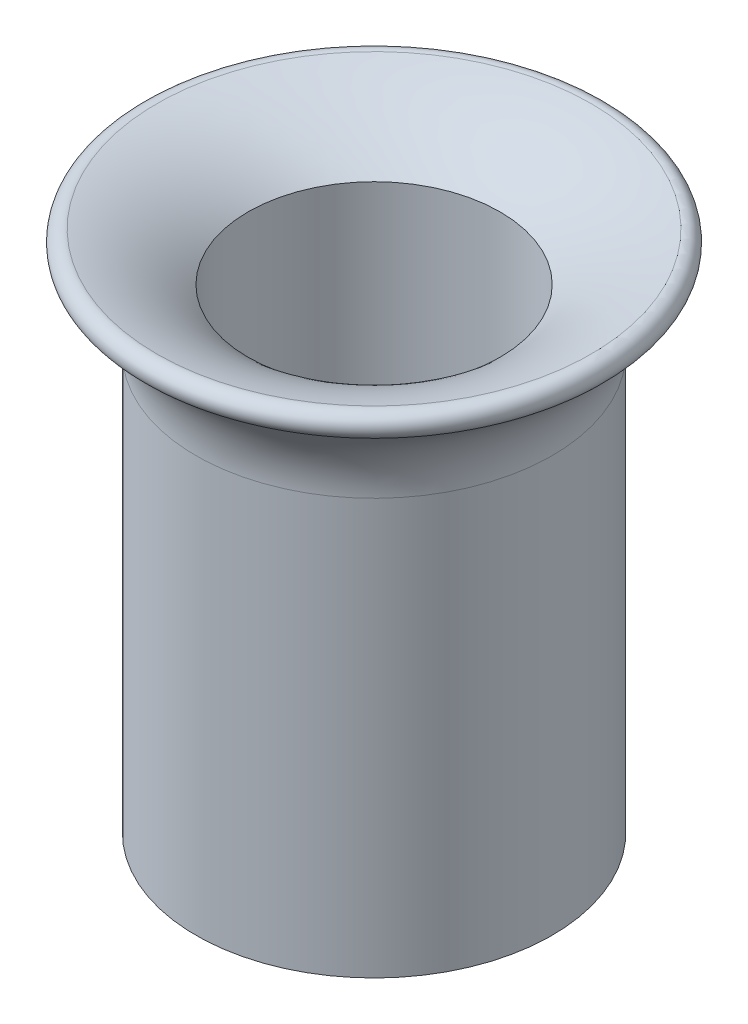
from build123d import *

# Parameters (mm, degrees)
SKETCH3_R          = 21.233227614
CUT_EXTRUDE1_DEPTH = 70


with BuildPart() as part:
    # Sketch1 → Revolve2 (revolve)
    with BuildSketch(Plane.XY, mode=Mode.PRIVATE) as revolve2_sk:
        with BuildLine():
            Line((0, 0), (30, 0))
            Line((30, 0), (30, 80))
            Line((30, 80), (8.888669742, 80))
            Line((8.888669742, 80), (8.766772386, 80))
            ThreePointArc((8.766772386, 80), (1.622655606, 85.063799106), (-6.577845512, 88.134995516))
            ThreePointArc((-6.577845512, 88.134995516), (-8.881517974, 86.949044637), (-8.081497092, 84.484627285))
            ThreePointArc((-8.081497092, 84.484627285), (-2.157248411, 78.299991195), (0, 70.011883734))
            Line((0, 70.011883734), (0, 0))
        make_face()
    revolve(revolve2_sk.sketch.rotate(Axis((30, 0, 0), (0, 1, 0)), 270), axis=Axis((30, 0, 0), (0, 1, 0)))

    # Sketch3 → Cut-Extrude1 (cut)
    with BuildSketch(Plane(origin=(0, 80, 0), x_dir=(1, 0, 0), z_dir=(0, 1, 0))):
        with Locations(Location((30, 0, 0), (0, 0, 270))):
            Circle(SKETCH3_R)
    extrude(amount=-CUT_EXTRUDE1_DEPTH, mode=Mode.SUBTRACT)


solid = part.part
